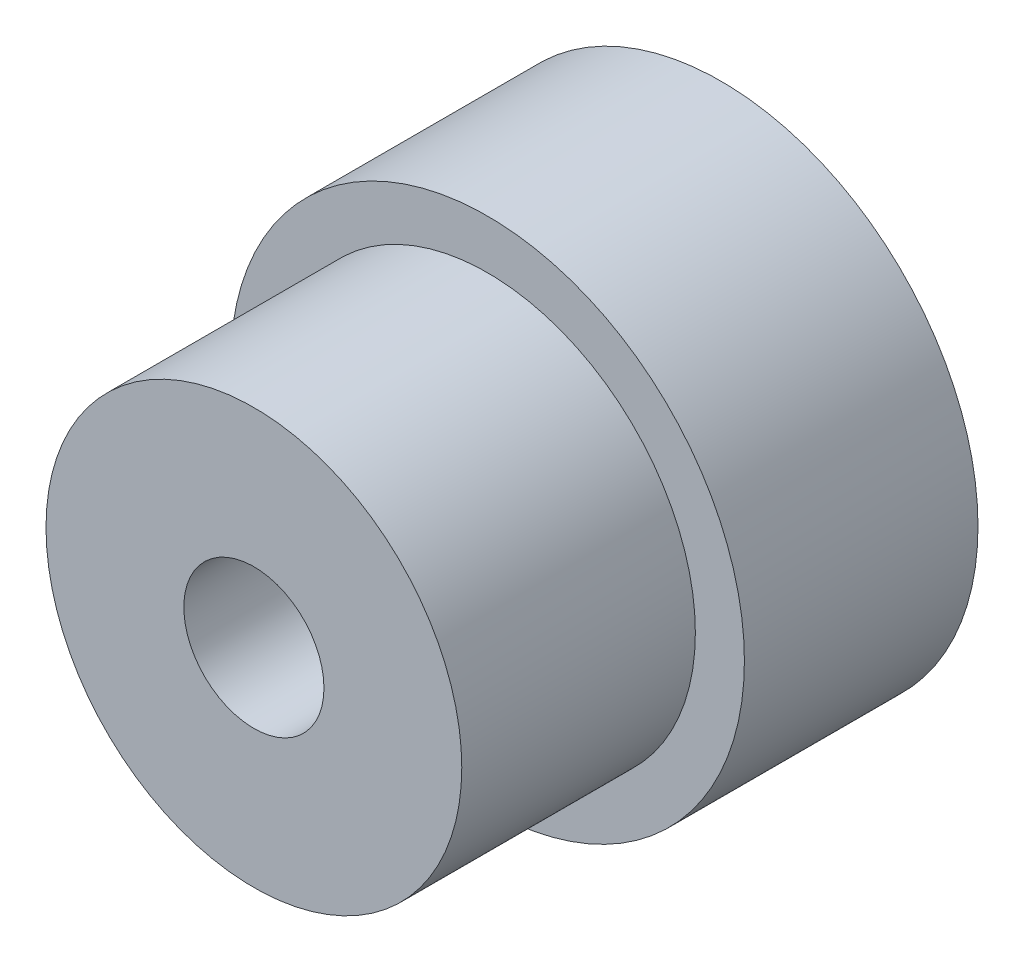
from build123d import *

# Parameters (mm, degrees)
SKETCH_1_R          = 5.5
EXTRUDE_1_DEPTH     = 5
SKETCH_2_R          = 4.45
EXTRUDE_2_DEPTH     = 5
SKETCH_3_R          = 1.5
CUT_EXTRUDE_1_DEPTH = 13.668859459


with BuildPart() as part:
    # 草图1 → 凸台-拉伸1 (new body)
    with BuildSketch(Plane.XY):
        Circle(SKETCH_1_R)
    extrude(amount=EXTRUDE_1_DEPTH)

    # 草图2 → 凸台-拉伸2 (add)
    with BuildSketch(Plane.XY.offset(5)):
        Circle(SKETCH_2_R)
    extrude(amount=EXTRUDE_2_DEPTH)

    # 草图3 → 切除-拉伸1 (cut, through all)
    with BuildSketch(Plane.XY.offset(10)):
        Circle(SKETCH_3_R)
    extrude(amount=-CUT_EXTRUDE_1_DEPTH, mode=Mode.SUBTRACT)


solid = part.part
